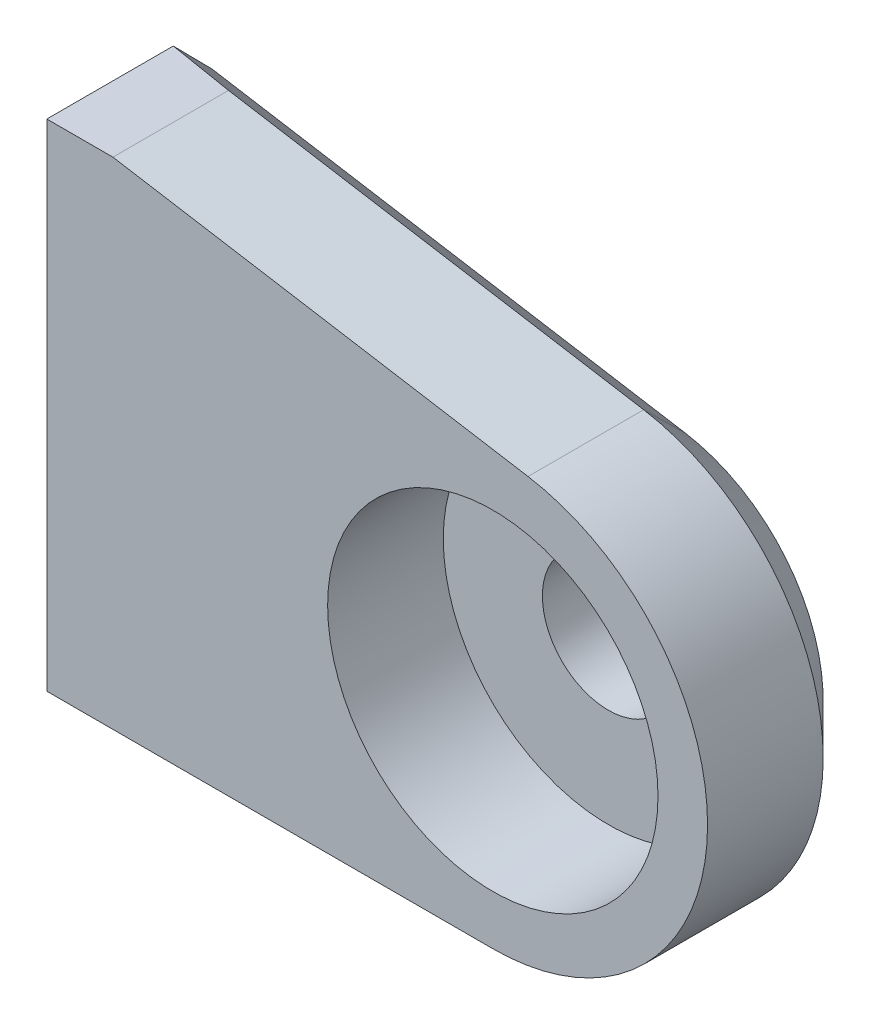
from build123d import *

# Parameters (mm, degrees)
SKETCH1_R           = 2
BOSS_EXTRUDE1_DEPTH = 5
SKETCH2_R           = 5
CUT_EXTRUDE1_DEPTH  = 3.5
SKETCH3_R           = 1
CUT_EXTRUDE2_DEPTH  = 2
CHAMFER1_SIZE       = 1.5


with BuildPart() as part:
    # Sketch1 → Boss-Extrude1 (new body)
    with BuildSketch(Plane.XY):
        with BuildLine():
            Line((0, -6.5), (-13.5, -6.5))
            Line((-13.5, -6.5), (-13.5, 8.5))
            Line((-13.5, 8.5), (-11.5, 8.5))
            Line((-11.5, 8.5), (1.065452768, 6.412083156))
            ThreePointArc((1.065452768, 6.412083156), (6.477983502, -0.534536942), (0, -6.5))
        make_face()
        Circle(SKETCH1_R, mode=Mode.SUBTRACT)
    extrude(amount=BOSS_EXTRUDE1_DEPTH)

    # Sketch2 → Cut-Extrude1 (cut)
    with BuildSketch(Plane.XY.offset(5)):
        Circle(SKETCH2_R)
    extrude(amount=-CUT_EXTRUDE1_DEPTH, mode=Mode.SUBTRACT)

    # Sketch3 → Cut-Extrude2 (cut)
    with BuildSketch(Plane.ZY.offset(13.5)):
        with Locations(Location((2.5, 6, 0), (0, 0, 270))):
            Circle(SKETCH3_R)
        with Locations(Location((2.5, -4, 0), (0, 0, 90))):
            Circle(SKETCH3_R)
    extrude(amount=-CUT_EXTRUDE2_DEPTH, mode=Mode.SUBTRACT)

    # Chamfer1
    chamfer1_edges = [part.edges().sort_by_distance(p)[0] for p in [
        (-5.217273616, 7.456041578, 0),
        (6.477983502, -0.534536942, 0),
        (-6.75, -6.5, 0),
    ]]
    chamfer(chamfer1_edges, length=CHAMFER1_SIZE)


solid = part.part
